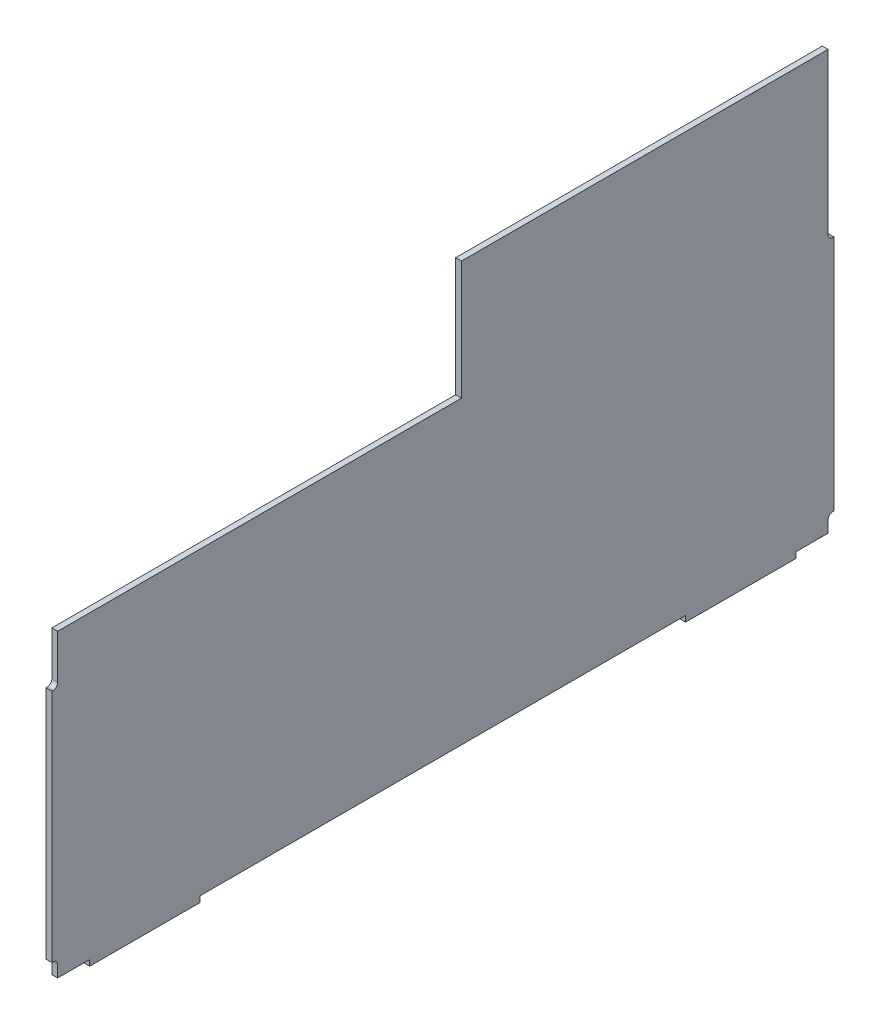
from build123d import *

# Parameters (mm, degrees)
BOSS_EXTRUDE1_DEPTH     = 3.175
CUT_EXTRUDE1_DEPTH      = 273.554100881
CUT_EXTRUDE1_DEPTH_BACK = 273.554100881


with BuildPart() as part:
    # Sketch1 → Boss-Extrude1 (new body)
    with BuildSketch(Plane(origin=(0, 0, 0), x_dir=(0, 0, -1), z_dir=(1, 0, 0))):
        with BuildLine():
            Line((-202.720111625, -68.875155483), (-185.257611625, -68.875155483))
            Line((-185.257611625, -68.875155483), (-185.257611625, -72.050155483))
            Line((-185.257611625, -72.050155483), (-124.932611625, -72.050155483))
            Line((-124.932611625, -72.050155483), (-124.932611625, -68.875155483))
            Line((-124.932611625, -68.875155483), (124.932611625, -68.875155483))
            Line((124.932611625, -68.875155483), (139.862388375, -68.875155483))
            Line((139.862388375, -68.875155483), (139.862388375, -72.050155483))
            Line((139.862388375, -72.050155483), (200.187388375, -72.050155483))
            Line((200.187388375, -72.050155483), (200.187388375, -68.875155483))
            Line((200.187388375, -68.875155483), (220.824888375, -68.875155483))
            Line((220.824888375, -68.875155483), (220.824888375, 69.554844517))
            Line((220.824888375, 69.554844517), (220.189888375, 69.554844517))
            ThreePointArc((220.189888375, 69.554844517), (218.393837151, 70.298793293), (217.649888375, 72.094844517))
            Line((217.649888375, 72.094844517), (217.649888375, 159.724844517))
            Line((217.649888375, 159.724844517), (17.624888375, 159.724844517))
            Line((17.624888375, 159.724844517), (17.624888375, 94.954844517))
            Line((17.624888375, 94.954844517), (-202.720111625, 94.954844517))
            Line((-202.720111625, 94.954844517), (-202.720111625, 70.824844517))
            ThreePointArc((-202.720111625, 70.824844517), (-203.4640604, 69.028793293), (-205.260111625, 68.284844517))
            Line((-205.260111625, 68.284844517), (-205.895111625, 68.284844517))
            Line((-205.895111625, 68.284844517), (-205.895111625, -59.985155483))
            Line((-205.895111625, -59.985155483), (-205.260111625, -59.985155483))
            ThreePointArc((-205.260111625, -59.985155483), (-203.4640604, -60.729104259), (-202.720111625, -62.525155483))
            Line((-202.720111625, -62.525155483), (-202.720111625, -68.875155483))
        make_face()
    extrude(amount=BOSS_EXTRUDE1_DEPTH)

    # Sketch2 → Cut-Extrude1 (cut, two sides: drawn at the far end of the back side and taken through both)
    with BuildSketch(Plane(origin=(3.175, 0, 0), x_dir=(0, 0, -1), z_dir=(1, 0, 0)).offset(-CUT_EXTRUDE1_DEPTH_BACK)):
        with BuildLine():
            Line((220.824888375, -68.875155483), (217.649888375, -68.875155483))
            Line((217.649888375, -68.875155483), (217.649888375, -62.525155483))
            ThreePointArc((217.649888375, -62.525155483), (218.393837151, -60.729104259), (220.189888375, -59.985155483))
            Line((220.189888375, -59.985155483), (220.824888375, -59.985155483))
            Line((220.824888375, -59.985155483), (220.824888375, -68.875155483))
        make_face()
    extrude(amount=CUT_EXTRUDE1_DEPTH + CUT_EXTRUDE1_DEPTH_BACK, mode=Mode.SUBTRACT)


solid = part.part
